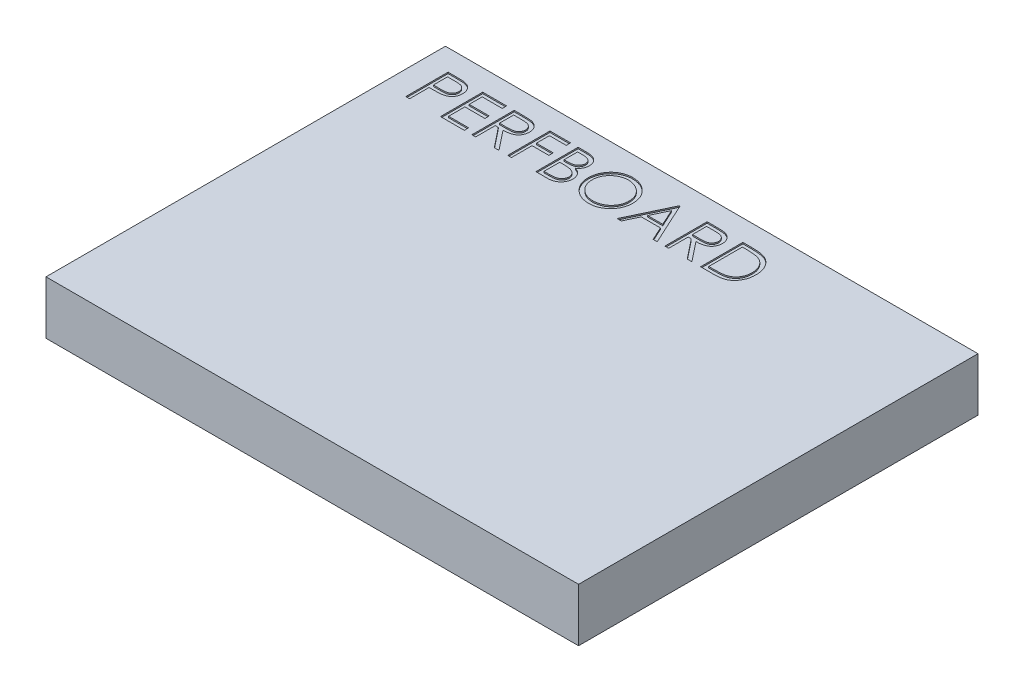
from build123d import *

# Parameters (mm, degrees)
SKETCH1_W           = 40
SKETCH1_H           = 30
BOSS_EXTRUDE1_DEPTH = 4
CUT_EXTRUDE1_DEPTH  = 0.1


with BuildPart() as part:
    # Sketch1 → Boss-Extrude1 (new body)
    with BuildSketch(Plane(origin=(0, 0, 0), x_dir=(1, 0, 0), z_dir=(0, 1, 0))):
        Rectangle(SKETCH1_W, SKETCH1_H)
    extrude(amount=BOSS_EXTRUDE1_DEPTH)

    # Sketch2 → Cut-Extrude1 (cut)
    # profile 1 of 9: a face of its own
    with BuildSketch(Plane(origin=(0, 4, 0), x_dir=(1, 0, 0), z_dir=(0, 1, 0))):
        with BuildLine():
            Line((-18.214234084, 13.412396468), (-17.591572826, 13.412396468))
            add(Edge.make_bspline(
                [(-17.591572826, 13.412396468), (-17.548745789, 13.412349391), (-17.466687286, 13.412259189), (-17.3490172, 13.409524384), (-17.242146943, 13.405871599), (-17.146306955, 13.400808024), (-17.061202351, 13.394823975), (-16.98721823, 13.386431053), (-16.923773061, 13.377667785), (-16.885757924, 13.368758366), (-16.868420782, 13.364695146)],
                knots=[0, 0, 0, 0, 1.415646017, 2.712440637, 3.8905458, 4.950247383, 5.884950622, 6.709939814, 7.411656543, 8, 8, 8, 8], degree=3))
            add(Edge.make_bspline(
                [(-16.868420782, 13.364695146), (-16.846473791, 13.358688092), (-16.803096962, 13.346815532), (-16.740593873, 13.32303594), (-16.68112717, 13.294839975), (-16.624492828, 13.262705401), (-16.571386795, 13.225253497), (-16.521016744, 13.184002429), (-16.47382719, 13.137999792), (-16.430083499, 13.087761549), (-16.389910861, 13.034131073), (-16.355321792, 12.976307765), (-16.326359236, 12.91526494), (-16.301518697, 12.851045057), (-16.283640313, 12.783108835), (-16.270172054, 12.711928317), (-16.261623478, 12.637511134), (-16.260804725, 12.586656826), (-16.26038793, 12.560768864)],
                knots=[0, 0, 0, 0, 0.999701418, 1.975846123, 2.934577507, 3.890451536, 4.834027766, 5.787354733, 6.749476667, 7.726910423, 8.712836071, 9.690891519, 10.682875813, 11.679750201, 12.712814741, 13.765529915, 14.8625177, 16, 16, 16, 16], degree=3))
            add(Edge.make_bspline(
                [(-16.26038793, 12.560768864), (-16.260770222, 12.53466331), (-16.261518203, 12.483586029), (-16.270495548, 12.408862142), (-16.282587936, 12.337453317), (-16.301181691, 12.269517887), (-16.325534551, 12.205459295), (-16.354102342, 12.144298606), (-16.38855883, 12.087076332), (-16.428150926, 12.033584733), (-16.472194158, 11.983773598), (-16.52050218, 11.938003892), (-16.572879967, 11.896543527), (-16.629161058, 11.859299559), (-16.689894136, 11.827135648), (-16.754158089, 11.798327236), (-16.8225115, 11.774132773), (-16.869812209, 11.761405503), (-16.893861488, 11.754934529)],
                knots=[0, 0, 0, 0, 1.121902311, 2.195077645, 3.232258892, 4.234102512, 5.217864754, 6.176164875, 7.132989551, 8.084763148, 9.034132444, 9.988522005, 10.94243251, 11.903244335, 12.886203696, 13.894208494, 14.929344452, 16, 16, 16, 16], degree=3))
            add(Edge.make_bspline(
                [(-16.893861488, 11.754934529), (-16.913752712, 11.750704539), (-16.957345487, 11.74143427), (-17.029139242, 11.73108517), (-17.112728271, 11.722251775), (-17.207998482, 11.715628601), (-17.31486436, 11.709958623), (-17.433383715, 11.705451853), (-17.563789199, 11.702975485), (-17.654749542, 11.702847766), (-17.702239893, 11.702781084)],
                knots=[0, 0, 0, 0, 0.601384939, 1.31797006, 2.144135048, 3.087295005, 4.142315834, 5.309527816, 6.595305764, 8, 8, 8, 8], degree=3))
            Line((-17.702239893, 11.702781084), (-17.929298186, 11.702781084))
            Line((-17.929298186, 11.702781084), (-17.929298186, 10.237396468))
            Line((-17.929298186, 10.237396468), (-18.214234084, 10.237396468))
            Line((-18.214234084, 10.237396468), (-18.214234084, 13.412396468))
        make_face()
        with BuildLine():
            Line((-17.929298186, 13.086755443), (-17.929298186, 12.028422109))
            Line((-17.929298186, 12.028422109), (-17.373418779, 12.021425916))
            add(Edge.make_bspline(
                [(-17.373418779, 12.021425916), (-17.346277132, 12.021411888), (-17.293880742, 12.021384808), (-17.218192168, 12.024999975), (-17.147970886, 12.029173315), (-17.083432593, 12.03528376), (-17.024548195, 12.043920901), (-16.971219508, 12.05264012), (-16.923860045, 12.06525427), (-16.86843434, 12.082238769), (-16.806673018, 12.111206213), (-16.73948317, 12.153252185), (-16.682541281, 12.206846827), (-16.633266826, 12.26710636), (-16.594163637, 12.334143427), (-16.565537844, 12.405870248), (-16.548718365, 12.481551226), (-16.546463033, 12.533338324), (-16.545323827, 12.559496829)],
                knots=[0, 0, 0, 0, 1.160613943, 2.240541288, 3.23993089, 4.169200891, 5.011653406, 5.7853311, 6.478053781, 7.106038997, 8.262395093, 9.384106736, 10.481365981, 11.59014053, 12.70357646, 13.786202915, 14.881775077, 16, 16, 16, 16], degree=3))
            add(Edge.make_bspline(
                [(-16.545323827, 12.559496829), (-16.546469228, 12.58502248), (-16.548746143, 12.635764316), (-16.565669676, 12.710130764), (-16.594107982, 12.781101724), (-16.633529321, 12.847298737), (-16.681373061, 12.907341438), (-16.736980322, 12.959499546), (-16.800220209, 13.001429233), (-16.859046819, 13.028492282), (-16.911299323, 13.045016139), (-16.956685458, 13.05657753), (-17.00793057, 13.065808258), (-17.065051341, 13.073282664), (-17.127605041, 13.079681161), (-17.196129084, 13.084022726), (-17.270363888, 13.086564047), (-17.321899192, 13.0866901), (-17.348614092, 13.086755443)],
                knots=[0, 0, 0, 0, 1.120700087, 2.227813068, 3.331159281, 4.466773991, 5.599788987, 6.693661531, 7.80175334, 8.91857717, 9.525282508, 10.207424825, 10.974604443, 11.810962634, 12.737642355, 13.736264703, 14.826523623, 16, 16, 16, 16], degree=3))
            Line((-17.348614092, 13.086755443), (-17.929298186, 13.086755443))
        make_face(mode=Mode.SUBTRACT)
    # profile 2 of 9: a face of its own
    with BuildSketch(Plane(origin=(0, 4, 0), x_dir=(1, 0, 0), z_dir=(0, 1, 0))):
        Polygon((-15.609105879, 13.412396468), (-13.818080238, 13.412396468), (-13.818080238, 13.086755443), (-15.324169981, 13.086755443), (-15.324169981, 12.109832366), (-13.818080238, 12.109832366), (-13.818080238, 11.78419134), (-15.324169981, 11.78419134), (-15.324169981, 10.563037494), (-13.818080238, 10.563037494), (-13.818080238, 10.237396468), (-15.609105879, 10.237396468), align=None)
    # profile 3 of 9: a face of its own
    with BuildSketch(Plane(origin=(0, 4, 0), x_dir=(1, 0, 0), z_dir=(0, 1, 0))):
        with BuildLine():
            Line((-13.248208443, 13.412396468), (-12.612826832, 13.412396468))
            add(Edge.make_bspline(
                [(-12.612826832, 13.412396468), (-12.570425951, 13.41225533), (-12.489011563, 13.411984328), (-12.372377239, 13.410473243), (-12.266398373, 13.40614222), (-12.171130376, 13.402415148), (-12.086574996, 13.395618887), (-12.012472953, 13.389123157), (-11.949165542, 13.380619908), (-11.91084252, 13.372722845), (-11.893490895, 13.36914727)],
                knots=[0, 0, 0, 0, 1.410062039, 2.707475311, 3.878576406, 4.937260626, 5.877586885, 6.699081471, 7.410979367, 8, 8, 8, 8], degree=3))
            add(Edge.make_bspline(
                [(-11.893490895, 13.36914727), (-11.870262028, 13.36340799), (-11.824299831, 13.352051864), (-11.758123699, 13.328049226), (-11.695064277, 13.300272852), (-11.635383508, 13.26764862), (-11.579380326, 13.229934356), (-11.526477287, 13.187781131), (-11.476434331, 13.141419594), (-11.43127528, 13.089680845), (-11.388694855, 13.035400583), (-11.352782315, 12.976705032), (-11.321824723, 12.91532636), (-11.297177182, 12.850640346), (-11.277330735, 12.78327431), (-11.263336932, 12.712618044), (-11.254944783, 12.638993445), (-11.254090386, 12.588775914), (-11.253657161, 12.563312935)],
                knots=[0, 0, 0, 0, 1.027469482, 2.033020251, 3.019912614, 3.986113645, 4.951240523, 5.91722682, 6.890402269, 7.87763091, 8.8651537, 9.85103654, 10.82876324, 11.815024772, 12.821070561, 13.842952187, 14.906261191, 16, 16, 16, 16], degree=3))
            add(Edge.make_bspline(
                [(-11.253657161, 12.563312935), (-11.254989752, 12.521008233), (-11.257589982, 12.438460802), (-11.281833469, 12.318662717), (-11.321545026, 12.20691241), (-11.376266867, 12.103350588), (-11.445953106, 12.009995931), (-11.529704881, 11.927998875), (-11.627568914, 11.859382669), (-11.71867265, 11.811800482), (-11.799149103, 11.781326915), (-11.865400751, 11.759885361), (-11.937670081, 11.743319149), (-12.015264663, 11.728478173), (-12.098507407, 11.717273421), (-12.1871988, 11.709066868), (-12.281402095, 11.703937838), (-12.346116822, 11.703174019), (-12.379408363, 11.702781084)],
                knots=[0, 0, 0, 0, 1.260483769, 2.459530307, 3.627416485, 4.787058657, 5.939039949, 7.08810263, 8.267026773, 9.491475466, 10.141966685, 10.831826277, 11.566392101, 12.351337768, 13.187381173, 14.07005841, 15.007169909, 16, 16, 16, 16], degree=3))
            Line((-12.379408363, 11.702781084), (-11.212952032, 10.237396468))
            Line((-11.212952032, 10.237396468), (-11.565305798, 10.237396468))
            Line((-11.565305798, 10.237396468), (-12.731762129, 11.702781084))
            Line((-12.731762129, 11.702781084), (-12.963272545, 11.702781084))
            Line((-12.963272545, 11.702781084), (-12.963272545, 10.237396468))
            Line((-12.963272545, 10.237396468), (-13.248208443, 10.237396468))
            Line((-13.248208443, 10.237396468), (-13.248208443, 13.412396468))
        make_face()
        with BuildLine():
            Line((-12.963272545, 13.086755443), (-12.963272545, 12.028422109))
            Line((-12.963272545, 12.028422109), (-12.381952433, 12.023969986))
            add(Edge.make_bspline(
                [(-12.381952433, 12.023969986), (-12.354810683, 12.023957979), (-12.302202242, 12.023934705), (-12.226092354, 12.02755763), (-12.155226252, 12.031679069), (-12.089874998, 12.037983118), (-12.030009398, 12.046107554), (-11.975659373, 12.056270262), (-11.926736205, 12.068110347), (-11.869678245, 12.086436108), (-11.805963677, 12.115470138), (-11.736720138, 12.157711698), (-11.677753732, 12.210842256), (-11.627935386, 12.271596748), (-11.587903687, 12.338395345), (-11.559680609, 12.410437338), (-11.541771394, 12.485904001), (-11.53965907, 12.537772714), (-11.538593058, 12.563948952)],
                knots=[0, 0, 0, 0, 1.146690395, 2.22261258, 3.21895312, 4.145990853, 4.996080663, 5.770904154, 6.481378293, 7.121626537, 8.300444488, 9.431385265, 10.535395872, 11.636531494, 12.74115979, 13.810798291, 14.895190096, 16, 16, 16, 16], degree=3))
            add(Edge.make_bspline(
                [(-11.538593058, 12.563948952), (-11.539683554, 12.589481916), (-11.541844518, 12.640078932), (-11.559487329, 12.714152508), (-11.589322697, 12.784063241), (-11.629529298, 12.849526738), (-11.678514246, 12.908949799), (-11.735952547, 12.959792573), (-11.800273689, 13.001747445), (-11.860391133, 13.02855749), (-11.914125026, 13.044994786), (-11.960779075, 13.056561913), (-12.013494486, 13.06585511), (-12.072527224, 13.073300993), (-12.137625275, 13.079700836), (-12.209117794, 13.084011378), (-12.286530445, 13.086563954), (-12.340185161, 13.086690128), (-12.367960045, 13.086755443)],
                knots=[0, 0, 0, 0, 1.101028733, 2.181837193, 3.264309656, 4.369019818, 5.486613113, 6.575447106, 7.666700264, 8.788928104, 9.402425223, 10.0903467, 10.862060571, 11.710948788, 12.657782767, 13.684531032, 14.801375019, 16, 16, 16, 16], degree=3))
            Line((-12.367960045, 13.086755443), (-12.963272545, 13.086755443))
        make_face(mode=Mode.SUBTRACT)
    # profile 4 of 9: a face of its own
    with BuildSketch(Plane(origin=(0, 4, 0), x_dir=(1, 0, 0), z_dir=(0, 1, 0))):
        Polygon((-10.561669981, 13.412396468), (-9.014875109, 13.412396468), (-9.014875109, 13.086755443), (-10.276734084, 13.086755443), (-10.276734084, 12.109832366), (-9.014875109, 12.109832366), (-9.014875109, 11.78419134), (-10.276734084, 11.78419134), (-10.276734084, 10.237396468), (-10.561669981, 10.237396468), align=None)
    # profile 5 of 9: a face of its own
    with BuildSketch(Plane(origin=(0, 4, 0), x_dir=(1, 0, 0), z_dir=(0, 1, 0))):
        with BuildLine():
            Line((-8.445003314, 13.412396468), (-7.825522145, 13.412396468))
            add(Edge.make_bspline(
                [(-7.825522145, 13.412396468), (-7.795197739, 13.412237038), (-7.736421495, 13.411928021), (-7.650951001, 13.407135467), (-7.570896723, 13.400600709), (-7.496235444, 13.390231982), (-7.427001664, 13.37772087), (-7.362986736, 13.362569937), (-7.304394222, 13.344402937), (-7.234441954, 13.315513811), (-7.154685355, 13.272584937), (-7.068326813, 13.209149738), (-6.994481539, 13.131559575), (-6.930812522, 13.044036023), (-6.880192935, 12.947755716), (-6.843572216, 12.845013452), (-6.820387571, 12.737134443), (-6.818003206, 12.663072418), (-6.816798186, 12.625642662)],
                knots=[0, 0, 0, 0, 1.001505555, 1.941167018, 2.826882275, 3.653841531, 4.429895133, 5.150066043, 5.825578002, 6.45369114, 7.647487171, 8.808567382, 9.977351308, 11.170798116, 12.373658725, 13.556498008, 14.765093433, 16, 16, 16, 16], degree=3))
            add(Edge.make_bspline(
                [(-6.816798186, 12.625642662), (-6.817789892, 12.590579273), (-6.819738686, 12.521676405), (-6.838373903, 12.420898177), (-6.867548224, 12.324966714), (-6.908102272, 12.234232122), (-6.960809082, 12.150744487), (-7.023273414, 12.073830324), (-7.098635942, 12.006746151), (-7.155099453, 11.969242233), (-7.183780358, 11.950191941)],
                knots=[0, 0, 0, 0, 1.044552857, 2.05264487, 3.044412934, 4.028983338, 5.005914585, 5.980388656, 6.974128949, 8, 8, 8, 8], degree=3))
            add(Edge.make_bspline(
                [(-7.183780358, 11.950191941), (-7.14771197, 11.936344406), (-7.078704209, 11.909850642), (-6.983739041, 11.8630099), (-6.901919431, 11.812062843), (-6.832616306, 11.756426093), (-6.773345719, 11.696455957), (-6.721590551, 11.631273104), (-6.67742959, 11.56002723), (-6.639590009, 11.483461166), (-6.610063637, 11.402356727), (-6.58795121, 11.317474666), (-6.575280738, 11.229119355), (-6.573477664, 11.168989047), (-6.572567417, 11.138633448)],
                knots=[0, 0, 0, 0, 1.27268992, 2.434971085, 3.483601985, 4.442670788, 5.356604649, 6.2567628, 7.179492994, 8.113709626, 9.066344395, 10.018646069, 10.999752585, 12, 12, 12, 12], degree=3))
            add(Edge.make_bspline(
                [(-6.572567417, 11.138633448), (-6.573453556, 11.107639214), (-6.575197059, 11.04665719), (-6.588060319, 10.957072175), (-6.609840009, 10.871460616), (-6.639840263, 10.789268772), (-6.678994649, 10.71065565), (-6.726645016, 10.635532189), (-6.783460792, 10.564653189), (-6.847017823, 10.497231045), (-6.918919912, 10.436608695), (-6.996494918, 10.382619447), (-7.080719794, 10.338218377), (-7.170211246, 10.300920271), (-7.265973161, 10.272429456), (-7.367575527, 10.252497192), (-7.474930715, 10.239066909), (-7.54859956, 10.23796273), (-7.586379516, 10.237396468)],
                knots=[0, 0, 0, 0, 0.978564426, 1.925352924, 2.850884081, 3.763762016, 4.682927383, 5.618979971, 6.567305752, 7.547517671, 8.540179244, 9.531824382, 10.526200242, 11.540722885, 12.589160233, 13.674978461, 14.80764778, 16, 16, 16, 16], degree=3))
            Line((-7.586379516, 10.237396468), (-8.445003314, 10.237396468))
            Line((-8.445003314, 10.237396468), (-8.445003314, 13.412396468))
        make_face()
        with BuildLine():
            Line((-8.160067417, 13.086755443), (-8.160067417, 12.069127238))
            Line((-8.160067417, 12.069127238), (-7.968626111, 12.069127238))
            add(Edge.make_bspline(
                [(-7.968626111, 12.069127238), (-7.940641847, 12.069490025), (-7.886570545, 12.070191004), (-7.808266067, 12.07219898), (-7.735581229, 12.077821491), (-7.668641495, 12.083442386), (-7.607552278, 12.092581476), (-7.552448918, 12.103460045), (-7.502466619, 12.114965251), (-7.444827175, 12.134531857), (-7.379446714, 12.163449463), (-7.309748112, 12.208327486), (-7.248303272, 12.261780292), (-7.196417252, 12.323457807), (-7.153952561, 12.391372133), (-7.124457976, 12.46443966), (-7.10445794, 12.540839351), (-7.102651337, 12.593288766), (-7.101734084, 12.619918504)],
                knots=[0, 0, 0, 0, 1.156816544, 2.235205308, 3.236616184, 4.169592532, 5.011045266, 5.787822928, 6.49130361, 7.128639758, 8.301311294, 9.436451833, 10.541879658, 11.654887649, 12.756523258, 13.837046038, 14.901820046, 16, 16, 16, 16], degree=3))
            add(Edge.make_bspline(
                [(-7.101734084, 12.619918504), (-7.102211404, 12.637540454), (-7.103147721, 12.672107833), (-7.110816074, 12.722499032), (-7.123849516, 12.769891579), (-7.140590197, 12.814934951), (-7.163984221, 12.856220701), (-7.19152822, 12.895176314), (-7.224807382, 12.930475164), (-7.26268723, 12.963467495), (-7.306237909, 12.992717888), (-7.355433438, 13.018336295), (-7.410939403, 13.038965428), (-7.47182035, 13.057032223), (-7.539013408, 13.069721604), (-7.611743181, 13.080292891), (-7.69060539, 13.085674736), (-7.745165591, 13.086387172), (-7.773368699, 13.086755443)],
                knots=[0, 0, 0, 0, 0.91205012, 1.789085906, 2.630437955, 3.453916878, 4.269457761, 5.079663411, 5.91843418, 6.774407191, 7.675494373, 8.627863946, 9.638891023, 10.736472738, 11.911756761, 13.175263542, 14.539845004, 16, 16, 16, 16], degree=3))
            Line((-7.773368699, 13.086755443), (-8.160067417, 13.086755443))
        make_face(mode=Mode.SUBTRACT)
        with BuildLine():
            Line((-8.160067417, 11.743486212), (-8.160067417, 10.563037494))
            Line((-8.160067417, 10.563037494), (-7.75428817, 10.563037494))
            add(Edge.make_bspline(
                [(-7.75428817, 10.563037494), (-7.72524243, 10.563385608), (-7.669260596, 10.564056551), (-7.588433051, 10.566246897), (-7.513518379, 10.571229176), (-7.444858427, 10.579072196), (-7.381711802, 10.58757979), (-7.324836028, 10.599020023), (-7.27377006, 10.612127294), (-7.214556938, 10.632387579), (-7.147878756, 10.663862235), (-7.076023193, 10.711318712), (-7.012136552, 10.767854855), (-6.957884639, 10.833287899), (-6.913422856, 10.904436317), (-6.881078265, 10.979861027), (-6.861129416, 11.058315756), (-6.858714448, 11.111806988), (-6.857503314, 11.138633448)],
                knots=[0, 0, 0, 0, 1.160039823, 2.235823828, 3.228722157, 4.157150951, 4.99529583, 5.772374946, 6.472645482, 7.099169577, 8.269452708, 9.405989375, 10.527446681, 11.663510218, 12.788923519, 13.866172445, 14.929861265, 16, 16, 16, 16], degree=3))
            add(Edge.make_bspline(
                [(-6.857503314, 11.138633448), (-6.857753781, 11.155409549), (-6.858250673, 11.188691153), (-6.86574423, 11.237600503), (-6.876642527, 11.284976831), (-6.890731756, 11.330948781), (-6.911250844, 11.374685201), (-6.935205353, 11.417051095), (-6.963291767, 11.458102465), (-7.007056117, 11.510002152), (-7.070712132, 11.5697983), (-7.161160421, 11.628343034), (-7.264005291, 11.67555783), (-7.338597374, 11.695605212), (-7.377129717, 11.705961172)],
                knots=[0, 0, 0, 0, 0.723448775, 1.435228256, 2.130040452, 2.821711965, 3.505591119, 4.210454504, 4.921174351, 5.648778258, 7.137944449, 8.670945889, 10.280296675, 12, 12, 12, 12], degree=3))
            add(Edge.make_bspline(
                [(-7.377129717, 11.705961172), (-7.392577539, 11.709095427), (-7.426071605, 11.715891137), (-7.480688482, 11.723064554), (-7.543041734, 11.72945543), (-7.613275344, 11.734182694), (-7.691478172, 11.739069059), (-7.777817234, 11.740969361), (-7.87193994, 11.743236547), (-7.937247307, 11.743400861), (-7.971170181, 11.743486212)],
                knots=[0, 0, 0, 0, 0.634451884, 1.375622551, 2.216452059, 3.157844607, 4.20941857, 5.370758133, 6.634282058, 8, 8, 8, 8], degree=3))
            Line((-7.971170181, 11.743486212), (-8.160067417, 11.743486212))
        make_face(mode=Mode.SUBTRACT)
    # profile 6 of 9: a face of its own
    with BuildSketch(Plane(origin=(0, 4, 0), x_dir=(1, 0, 0), z_dir=(0, 1, 0))):
        with BuildLine():
            add(Edge.make_bspline(
                [(-4.435548186, 13.493806725), (-4.376757976, 13.492317669), (-4.261289152, 13.489393039), (-4.091585495, 13.467005567), (-3.92957423, 13.428274749), (-3.773935604, 13.3766919), (-3.626531261, 13.307881136), (-3.486251694, 13.224709609), (-3.353430673, 13.126305964), (-3.22985842, 13.01343088), (-3.116776758, 12.890618747), (-3.01714899, 12.759556643), (-2.93365348, 12.621037015), (-2.865086373, 12.475476118), (-2.811294063, 12.323203147), (-2.774174645, 12.163406302), (-2.750463609, 11.997120947), (-2.747691582, 11.88370372), (-2.746285366, 11.826168504)],
                knots=[0, 0, 0, 0, 1.065120563, 2.091984664, 3.0946048, 4.079830382, 5.057816894, 6.036188127, 7.030412546, 8.04752943, 9.064399622, 10.05169764, 11.02544977, 11.989514704, 12.962713494, 13.945757189, 14.957906945, 16, 16, 16, 16], degree=3))
            add(Edge.make_bspline(
                [(-2.746285366, 11.826168504), (-2.747691376, 11.769057106), (-2.750462785, 11.656483925), (-2.774201605, 11.4912538), (-2.811431655, 11.332421526), (-2.864586839, 11.180252255), (-2.932827094, 11.034585465), (-3.016878571, 10.895804442), (-3.115885241, 10.76386369), (-3.228558599, 10.64020863), (-3.351386687, 10.526818067), (-3.483131286, 10.428013087), (-3.620829512, 10.342991917), (-3.766253318, 10.275152441), (-3.917474066, 10.22093077), (-4.075845173, 10.183962313), (-4.240624548, 10.16011621), (-4.352993244, 10.157377984), (-4.410107481, 10.155986212)],
                knots=[0, 0, 0, 0, 1.043624062, 2.057103931, 3.04512605, 4.022047818, 4.998200453, 5.980619268, 6.982898556, 8.009068085, 9.034988726, 10.034168286, 11.015286542, 11.987931943, 12.962482838, 13.94673481, 14.956375938, 16, 16, 16, 16], degree=3))
            add(Edge.make_bspline(
                [(-4.410107481, 10.155986212), (-4.467642399, 10.157391727), (-4.581059038, 10.160162372), (-4.747553348, 10.183912646), (-4.907462445, 10.221052258), (-5.060329035, 10.274128675), (-5.206238364, 10.342724305), (-5.345475796, 10.426366849), (-5.477482451, 10.525614756), (-5.601163892, 10.638251577), (-5.714329236, 10.760871485), (-5.812989527, 10.892256845), (-5.89665088, 11.029830009), (-5.965016189, 11.173972763), (-6.019140377, 11.323988286), (-6.056065462, 11.480877262), (-6.079955933, 11.643745243), (-6.082708972, 11.754637015), (-6.084105879, 11.810904081)],
                knots=[0, 0, 0, 0, 1.053102029, 2.075944431, 3.073151272, 4.055350789, 5.033113405, 6.020478099, 7.024410459, 8.052272461, 9.079885166, 10.07527673, 11.055994387, 12.023226415, 12.992069828, 13.970394897, 14.97016774, 16, 16, 16, 16], degree=3))
            add(Edge.make_bspline(
                [(-6.084105879, 11.810904081), (-6.083620888, 11.848670859), (-6.082657025, 11.923727971), (-6.071053132, 12.03518553), (-6.054215017, 12.144850626), (-6.030083283, 12.252411415), (-5.99852227, 12.357604594), (-5.961282217, 12.461155643), (-5.915798214, 12.562015164), (-5.864380769, 12.660660955), (-5.806993272, 12.75555527), (-5.743605985, 12.845253177), (-5.676445329, 12.930507367), (-5.602818537, 13.009108578), (-5.52515219, 13.083343395), (-5.442186375, 13.152071002), (-5.354427339, 13.215911136), (-5.261497466, 13.273442446), (-5.165686603, 13.325475375), (-5.066919811, 13.370126625), (-4.966538493, 13.408449838), (-4.864072491, 13.439511158), (-4.759793905, 13.464033077), (-4.653475143, 13.480731176), (-4.545200906, 13.492364665), (-4.472256353, 13.49332397), (-4.435548186, 13.493806725)],
                knots=[0, 0, 0, 0, 1.037015668, 2.060948919, 3.074880161, 4.083647147, 5.086022904, 6.090072063, 7.104153813, 8.122640571, 9.144368836, 10.147691507, 11.138137339, 12.123020368, 13.103399296, 14.087645067, 15.080126199, 16.082011238, 17.087798457, 18.072939717, 19.057185487, 20.037253025, 21.01195951, 21.997135196, 22.992090687, 24, 24, 24, 24], degree=3))
        make_face()
        with BuildLine():
            add(Edge.make_bspline(
                [(-4.421555798, 13.168165699), (-4.451686216, 13.167798406), (-4.511659002, 13.167067331), (-4.600817117, 13.15743736), (-4.688802657, 13.143712389), (-4.775633793, 13.124134867), (-4.860947213, 13.097461191), (-4.94553814, 13.066762652), (-5.028635196, 13.029369234), (-5.109964053, 12.987121138), (-5.188808442, 12.940358903), (-5.263205679, 12.888677372), (-5.333348363, 12.83328854), (-5.399064755, 12.774063145), (-5.46016189, 12.710699578), (-5.517842297, 12.644158439), (-5.569793989, 12.572537795), (-5.617405905, 12.497779783), (-5.660012446, 12.419981777), (-5.697899589, 12.339962831), (-5.728891226, 12.257070215), (-5.754166382, 12.172203229), (-5.77512121, 12.085496284), (-5.78839627, 11.996291621), (-5.798132053, 11.905037483), (-5.798821341, 11.84336823), (-5.799169981, 11.812176116)],
                knots=[0, 0, 0, 0, 1.008559885, 2.007477868, 2.99961109, 3.989939068, 4.984837346, 5.991145699, 7.001802488, 8.033829008, 9.059044045, 10.069351652, 11.065060232, 12.050310815, 13.029377138, 14.011219647, 14.996725999, 15.989392538, 16.977580475, 17.965360261, 18.951710183, 19.937753436, 20.929683414, 21.935841486, 22.955955122, 24, 24, 24, 24], degree=3))
            add(Edge.make_bspline(
                [(-5.799169981, 11.812176116), (-5.798013499, 11.766308958), (-5.795738342, 11.67607407), (-5.775819689, 11.54384154), (-5.745138326, 11.416761451), (-5.699910572, 11.295529148), (-5.643349658, 11.179102549), (-5.573475264, 11.068514482), (-5.490690237, 10.96373506), (-5.396652609, 10.865495781), (-5.293852725, 10.775828515), (-5.184693749, 10.697121709), (-5.070345119, 10.630528125), (-4.950508642, 10.576276381), (-4.825824089, 10.533287119), (-4.695488025, 10.503824361), (-4.560368679, 10.484433769), (-4.468265871, 10.482571626), (-4.421555798, 10.481627238)],
                knots=[0, 0, 0, 0, 1.032063989, 2.030389145, 3.003944642, 3.970395727, 4.937377036, 5.913328081, 6.909231446, 7.93887556, 8.970685674, 9.976071282, 10.964166581, 11.944589148, 12.933237628, 13.927779006, 14.949070134, 16, 16, 16, 16], degree=3))
            add(Edge.make_bspline(
                [(-4.421555798, 10.481627238), (-4.390160036, 10.482058588), (-4.32789281, 10.482914085), (-4.235277587, 10.491530742), (-4.14433088, 10.505348224), (-4.055180255, 10.525242461), (-3.96792689, 10.550140999), (-3.882206605, 10.579720866), (-3.798932441, 10.61662453), (-3.717053874, 10.657398743), (-3.638680141, 10.703880886), (-3.563863051, 10.75380835), (-3.494488412, 10.809115599), (-3.428821183, 10.867461043), (-3.367473208, 10.930021105), (-3.310859343, 10.996714449), (-3.259170223, 11.067962045), (-3.211576387, 11.142606663), (-3.169119141, 11.22061755), (-3.132126673, 11.300926615), (-3.100743054, 11.383336107), (-3.07540791, 11.467964889), (-3.05555467, 11.554652231), (-3.041875028, 11.643514202), (-3.032306087, 11.734373034), (-3.031584839, 11.795826389), (-3.031221263, 11.826804521)],
                knots=[0, 0, 0, 0, 1.047197238, 2.076906641, 3.100256066, 4.114471768, 5.12198147, 6.126382909, 7.136867548, 8.15857795, 9.17633901, 10.174870724, 11.156907918, 12.133735059, 13.104061851, 14.077631395, 15.04955518, 16.038496417, 17.029181396, 18.010275684, 18.986308667, 19.968651475, 20.955262928, 21.950658345, 22.966943676, 24, 24, 24, 24], degree=3))
            add(Edge.make_bspline(
                [(-3.031221263, 11.826804521), (-3.03158513, 11.857570729), (-3.032306927, 11.918601169), (-3.041870457, 12.00882634), (-3.055569122, 12.097048896), (-3.075311007, 12.182922488), (-3.100756504, 12.266469008), (-3.132132154, 12.347609986), (-3.169130247, 12.426647706), (-3.211591993, 12.503386818), (-3.259322062, 12.577023902), (-3.311477554, 12.647420376), (-3.368958977, 12.71325422), (-3.430124013, 12.776150692), (-3.496500459, 12.834768349), (-3.56778764, 12.889126636), (-3.64312012, 12.940537392), (-3.722882683, 12.98691558), (-3.805200413, 13.029745634), (-3.889668075, 13.066440473), (-3.975328758, 13.097620895), (-4.061964631, 13.124215571), (-4.150304904, 13.143635712), (-4.239752663, 13.157449729), (-4.330184155, 13.167063979), (-4.391001933, 13.167797294), (-4.421555798, 13.168165699)],
                knots=[0, 0, 0, 0, 1.02996197, 2.043119294, 3.035359645, 4.018872909, 4.991431989, 5.957985074, 6.929999688, 7.912076566, 8.892894881, 9.867085534, 10.843653904, 11.817741046, 12.803660682, 13.806313499, 14.818574707, 15.856120519, 16.894564902, 17.924820532, 18.937903209, 19.946497019, 20.957711757, 21.963978472, 22.977135795, 24, 24, 24, 24], degree=3))
        make_face(mode=Mode.SUBTRACT)
    # profile 7 of 9: a face of its own
    with BuildSketch(Plane(origin=(0, 4, 0), x_dir=(1, 0, 0), z_dir=(0, 1, 0))):
        Polygon((-0.792439212, 13.412396468), (0.672945403, 10.237396468), (0.363204819, 10.237396468), (-0.106176191, 11.255024674), (-1.545484084, 11.255024674), (-2.028221463, 10.237396468), (-2.339234084, 10.237396468), (-0.83314434, 13.412396468), align=None)
        Polygon((-0.815971864, 12.793551316), (-1.3909318, 11.580665699), (-0.256276351, 11.580665699), align=None, mode=Mode.SUBTRACT)
    # profile 8 of 9: a face of its own
    with BuildSketch(Plane(origin=(0, 4, 0), x_dir=(1, 0, 0), z_dir=(0, 1, 0))):
        with BuildLine():
            Line((1.242817198, 13.412396468), (1.878198809, 13.412396468))
            add(Edge.make_bspline(
                [(1.878198809, 13.412396468), (1.92059969, 13.41225533), (2.002014078, 13.411984328), (2.118648402, 13.410473243), (2.224627268, 13.40614222), (2.319895265, 13.402415148), (2.404450645, 13.395618887), (2.478552688, 13.389123157), (2.541860099, 13.380619908), (2.580183121, 13.372722845), (2.597534746, 13.36914727)],
                knots=[0, 0, 0, 0, 1.410062039, 2.707475311, 3.878576406, 4.937260626, 5.877586885, 6.699081471, 7.410979367, 8, 8, 8, 8], degree=3))
            add(Edge.make_bspline(
                [(2.597534746, 13.36914727), (2.620763613, 13.36340799), (2.66672581, 13.352051864), (2.732901942, 13.328049226), (2.795961364, 13.300272852), (2.855642133, 13.26764862), (2.911645315, 13.229934356), (2.964548354, 13.187781131), (3.01459131, 13.141419594), (3.059750361, 13.089680845), (3.102330786, 13.035400583), (3.138243326, 12.976705032), (3.169200918, 12.91532636), (3.193848459, 12.850640346), (3.213694906, 12.78327431), (3.227688709, 12.712618044), (3.236080858, 12.638993445), (3.236935255, 12.588775914), (3.23736848, 12.563312935)],
                knots=[0, 0, 0, 0, 1.027469482, 2.033020251, 3.019912614, 3.986113645, 4.951240523, 5.91722682, 6.890402269, 7.87763091, 8.8651537, 9.85103654, 10.82876324, 11.815024772, 12.821070561, 13.842952187, 14.906261191, 16, 16, 16, 16], degree=3))
            add(Edge.make_bspline(
                [(3.23736848, 12.563312935), (3.236035889, 12.521008233), (3.233435659, 12.438460802), (3.209192172, 12.318662717), (3.169480615, 12.20691241), (3.114758774, 12.103350588), (3.045072535, 12.009995931), (2.96132076, 11.927998875), (2.863456727, 11.859382669), (2.772352991, 11.811800482), (2.691876538, 11.781326915), (2.62562489, 11.759885361), (2.55335556, 11.743319149), (2.475760978, 11.728478173), (2.392518234, 11.717273421), (2.303826841, 11.709066868), (2.209623546, 11.703937838), (2.144908819, 11.703174019), (2.111617278, 11.702781084)],
                knots=[0, 0, 0, 0, 1.260483769, 2.459530307, 3.627416485, 4.787058657, 5.939039949, 7.08810263, 8.267026773, 9.491475466, 10.141966685, 10.831826277, 11.566392101, 12.351337768, 13.187381173, 14.07005841, 15.007169909, 16, 16, 16, 16], degree=3))
            Line((2.111617278, 11.702781084), (3.278073609, 10.237396468))
            Line((3.278073609, 10.237396468), (2.925719843, 10.237396468))
            Line((2.925719843, 10.237396468), (1.759263512, 11.702781084))
            Line((1.759263512, 11.702781084), (1.527753096, 11.702781084))
            Line((1.527753096, 11.702781084), (1.527753096, 10.237396468))
            Line((1.527753096, 10.237396468), (1.242817198, 10.237396468))
            Line((1.242817198, 10.237396468), (1.242817198, 13.412396468))
        make_face()
        with BuildLine():
            Line((1.527753096, 13.086755443), (1.527753096, 12.028422109))
            Line((1.527753096, 12.028422109), (2.109073208, 12.023969986))
            add(Edge.make_bspline(
                [(2.109073208, 12.023969986), (2.136214958, 12.023957979), (2.188823399, 12.023934705), (2.264933287, 12.02755763), (2.335799389, 12.031679069), (2.401150643, 12.037983118), (2.461016243, 12.046107554), (2.515366268, 12.056270262), (2.564289436, 12.068110347), (2.621347396, 12.086436108), (2.685061964, 12.115470138), (2.754305503, 12.157711698), (2.813271909, 12.210842256), (2.863090255, 12.271596748), (2.903121954, 12.338395345), (2.931345032, 12.410437338), (2.949254247, 12.485904001), (2.951366571, 12.537772714), (2.952432583, 12.563948952)],
                knots=[0, 0, 0, 0, 1.146690395, 2.22261258, 3.21895312, 4.145990853, 4.996080663, 5.770904154, 6.481378293, 7.121626537, 8.300444488, 9.431385265, 10.535395872, 11.636531494, 12.74115979, 13.810798291, 14.895190096, 16, 16, 16, 16], degree=3))
            add(Edge.make_bspline(
                [(2.952432583, 12.563948952), (2.951342087, 12.589481916), (2.949181123, 12.640078932), (2.931538312, 12.714152508), (2.901702944, 12.784063241), (2.861496343, 12.849526738), (2.812511395, 12.908949799), (2.755073094, 12.959792573), (2.690751952, 13.001747445), (2.630634508, 13.02855749), (2.576900615, 13.044994786), (2.530246566, 13.056561913), (2.477531155, 13.06585511), (2.418498417, 13.073300993), (2.353400366, 13.079700836), (2.281907847, 13.084011378), (2.204495196, 13.086563954), (2.15084048, 13.086690128), (2.123065596, 13.086755443)],
                knots=[0, 0, 0, 0, 1.101028733, 2.181837193, 3.264309656, 4.369019818, 5.486613113, 6.575447106, 7.666700264, 8.788928104, 9.402425223, 10.0903467, 10.862060571, 11.710948788, 12.657782767, 13.684531032, 14.801375019, 16, 16, 16, 16], degree=3))
            Line((2.123065596, 13.086755443), (1.527753096, 13.086755443))
        make_face(mode=Mode.SUBTRACT)
    # profile 9 of 9: a face of its own
    with BuildSketch(Plane(origin=(0, 4, 0), x_dir=(1, 0, 0), z_dir=(0, 1, 0))):
        with BuildLine():
            Line((3.92935566, 10.237396468), (3.92935566, 13.412396468))
            Line((3.92935566, 13.412396468), (4.570461429, 13.412396468))
            add(Edge.make_bspline(
                [(4.570461429, 13.412396468), (4.626222583, 13.411994994), (4.733952841, 13.411219348), (4.889629847, 13.406301372), (5.033669403, 13.397601449), (5.165597782, 13.384929093), (5.285777168, 13.369368842), (5.393871048, 13.349864903), (5.490438349, 13.326834206), (5.549828484, 13.30719869), (5.577913352, 13.297913295)],
                knots=[0, 0, 0, 0, 1.314313732, 2.53924729, 3.670748893, 4.714932338, 5.66265055, 6.526160246, 7.303039223, 8, 8, 8, 8], degree=3))
            add(Edge.make_bspline(
                [(5.577913352, 13.297913295), (5.614647866, 13.283915441), (5.687283876, 13.256237157), (5.790704623, 13.204025369), (5.888064059, 13.14486777), (5.979884283, 13.07868638), (6.06406789, 13.003607293), (6.143903625, 12.922819794), (6.216125553, 12.833386085), (6.282263793, 12.737160917), (6.341895427, 12.635277841), (6.393728806, 12.527930993), (6.436776357, 12.415665525), (6.472511641, 12.298793641), (6.500675213, 12.177058356), (6.519890251, 12.05031792), (6.532563935, 11.919073227), (6.53383761, 11.830014963), (6.534483865, 11.784827358)],
                knots=[0, 0, 0, 0, 0.984719456, 1.947108742, 2.898477687, 3.838006223, 4.779231079, 5.722358779, 6.681677486, 7.655904652, 8.64651281, 9.637519902, 10.640069247, 11.656948941, 12.698408672, 13.768548281, 14.867775369, 16, 16, 16, 16], degree=3))
            add(Edge.make_bspline(
                [(6.534483865, 11.784827358), (6.533913302, 11.745583234), (6.532788947, 11.66824859), (6.522693068, 11.554274349), (6.508018834, 11.443681324), (6.485300169, 11.336996153), (6.457720746, 11.233284127), (6.422374695, 11.133650591), (6.381883923, 11.037181564), (6.334667248, 10.945181425), (6.282831848, 10.85802008), (6.227204267, 10.775855137), (6.167843836, 10.699859043), (6.104184512, 10.629801659), (6.037048941, 10.565788598), (5.965997584, 10.507285127), (5.890847102, 10.455435967), (5.811934089, 10.408203661), (5.726956458, 10.36700091), (5.634304636, 10.332139402), (5.533583496, 10.303249972), (5.425040264, 10.279146374), (5.308487395, 10.260026249), (5.183810619, 10.247211593), (5.051201492, 10.238545718), (4.960143158, 10.23778699), (4.913274931, 10.237396468)],
                knots=[0, 0, 0, 0, 1.105936401, 2.179363191, 3.223086493, 4.248585256, 5.251745608, 6.245858792, 7.225916811, 8.198733463, 9.158002045, 10.082870192, 10.993790845, 11.873723703, 12.748670949, 13.606408763, 14.465103618, 15.319838547, 16.196477973, 17.123216899, 18.106603292, 19.147568657, 20.255746949, 21.433717677, 22.679120308, 24, 24, 24, 24], degree=3))
            Line((4.913274931, 10.237396468), (3.92935566, 10.237396468))
        make_face()
        with BuildLine():
            Line((4.214291557, 10.563037494), (4.578729658, 10.563037494))
            add(Edge.make_bspline(
                [(4.578729658, 10.563037494), (4.631097537, 10.563262553), (4.731820147, 10.563695424), (4.876652759, 10.567493815), (5.008986212, 10.57370043), (5.128839295, 10.582386393), (5.236144339, 10.593878637), (5.331125598, 10.606691942), (5.413471725, 10.622655343), (5.463300571, 10.637125142), (5.486326814, 10.643811733)],
                knots=[0, 0, 0, 0, 1.375205317, 2.645023457, 3.804390687, 4.853969522, 5.800190428, 6.637939096, 7.370582563, 8, 8, 8, 8], degree=3))
            add(Edge.make_bspline(
                [(5.486326814, 10.643811733), (5.515308542, 10.654018504), (5.572579771, 10.674188256), (5.655021898, 10.710979849), (5.73190861, 10.754560869), (5.804579847, 10.803004361), (5.872004742, 10.858018948), (5.934982333, 10.918408345), (5.993385824, 10.984479891), (6.046611803, 11.056151581), (6.094244336, 11.132977324), (6.135493237, 11.214201837), (6.17164427, 11.298935158), (6.200018421, 11.388478466), (6.222257559, 11.482031255), (6.238009811, 11.579600106), (6.247820311, 11.681166797), (6.248964625, 11.750247653), (6.249547968, 11.785463375)],
                knots=[0, 0, 0, 0, 0.998632004, 1.973411704, 2.929992603, 3.868527914, 4.809262121, 5.754881198, 6.702106254, 7.672490631, 8.653608572, 9.636854334, 10.631411391, 11.644891563, 12.686317036, 13.754757253, 14.855430412, 16, 16, 16, 16], degree=3))
            add(Edge.make_bspline(
                [(6.249547968, 11.785463375), (6.249082343, 11.82259589), (6.248167618, 11.895543043), (6.236670208, 12.002577459), (6.219868511, 12.105520621), (6.195571882, 12.204379412), (6.164610299, 12.299346703), (6.125970874, 12.389897259), (6.081823298, 12.47698739), (6.029296699, 12.558606993), (5.971769697, 12.635798599), (5.907926906, 12.706514844), (5.838782628, 12.770916816), (5.765091015, 12.830007479), (5.684775218, 12.881409527), (5.599727227, 12.927389588), (5.508699368, 12.966411147), (5.44536928, 12.987165544), (5.413184787, 12.997712975)],
                knots=[0, 0, 0, 0, 1.122418816, 2.205001699, 3.251619955, 4.274784885, 5.280384055, 6.268708349, 7.249350384, 8.229342522, 9.199999885, 10.157847722, 11.105861043, 12.055065948, 13.010012805, 13.98527497, 14.976112212, 16, 16, 16, 16], degree=3))
            add(Edge.make_bspline(
                [(5.413184787, 12.997712975), (5.386559104, 13.005075734), (5.329945597, 13.020730981), (5.237562654, 13.037808284), (5.13359034, 13.052870936), (5.01756704, 13.065623586), (4.889625009, 13.074774228), (4.749665849, 13.081642492), (4.597629065, 13.086274937), (4.49223491, 13.086591264), (4.437533745, 13.086755443)],
                knots=[0, 0, 0, 0, 0.674548936, 1.434276114, 2.292660221, 3.240891867, 4.284742987, 5.42552168, 6.663806718, 8, 8, 8, 8], degree=3))
            Line((4.437533745, 13.086755443), (4.214291557, 13.086755443))
            Line((4.214291557, 13.086755443), (4.214291557, 10.563037494))
        make_face(mode=Mode.SUBTRACT)
    extrude(amount=-CUT_EXTRUDE1_DEPTH, mode=Mode.SUBTRACT)


solid = part.part
